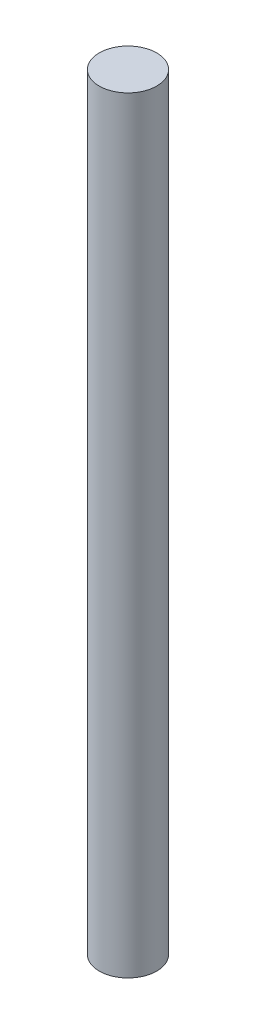
from build123d import *

# Parameters (mm, degrees)
ESQUISSE1_R        = 3
BOSS_EXTRU_1_DEPTH = 80


with BuildPart() as part:
    # Esquisse1 → Boss.-Extru.1 (new body)
    with BuildSketch(Plane(origin=(0, 0, 0), x_dir=(1, 0, 0), z_dir=(0, 1, 0))):
        with Locations(Location((0, 0, 0), (0, 0, 270))):
            Circle(ESQUISSE1_R)
    extrude(amount=BOSS_EXTRU_1_DEPTH)


solid = part.part
